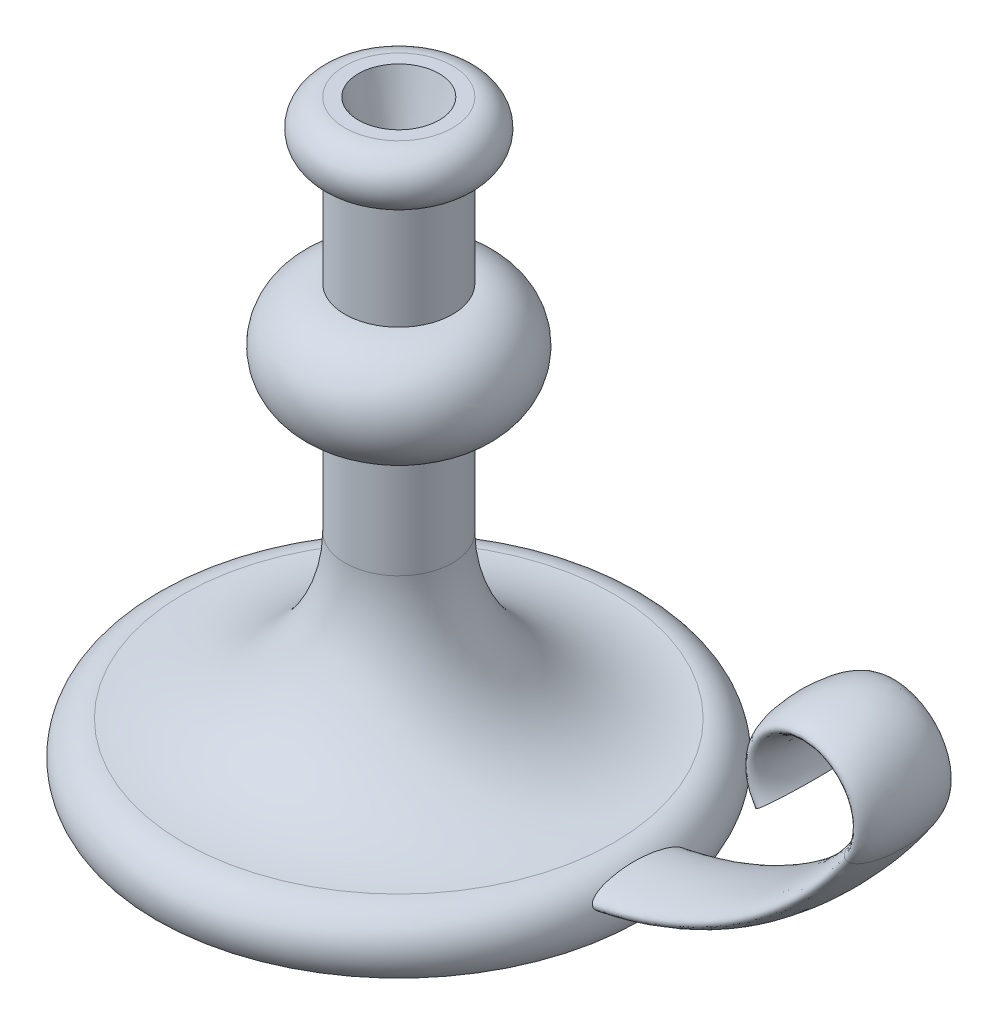
from build123d import *

# Parameters (mm, degrees)
SKETCH3_RX         = 17.5
SKETCH3_RY         = 5
SKETCH4_R          = 15
CUT_EXTRUDE1_DEPTH = 25
CUT_EXTRUDE1_DRAFT = -15


with BuildPart() as part:
    # Sketch1 → Revolve1 (revolve)
    with BuildSketch(Plane.XY, mode=Mode.PRIVATE) as revolve1_sk:
        with BuildLine():
            Line((0, 0), (0, -220))
            Line((0, -220), (90, -220))
            ThreePointArc((90, -220), (91.180339887, -206.909830056), (80, -200))
            ThreePointArc((80, -200), (37.573593129, -182.426406871), (20, -140))
            Line((20, -140), (20, -100))
            ThreePointArc((20, -100), (40, -80), (20, -60))
            Line((20, -60), (20, -20))
            ThreePointArc((20, -20), (30, -10), (20, 0))
            Line((20, 0), (0, 0))
        make_face()
    revolve(revolve1_sk.sketch.rotate(Axis((0, 0, 0), (0, -1, 0)), 90), axis=Axis((0, 0, 0), (0, -1, 0)))

    # Sweep1: sweep along a path in Sketch2
    with BuildLine(Plane.XY) as sweep1_path:
        Line((0, -210), (60, -210))
        ThreePointArc((60, -210), (129.821200219, -192.759180474), (183.592070943, -145))
        ThreePointArc((183.592070943, -145), (167.113128151, -113.666666667), (150.634185358, -145))
    # Sketch3 → Sweep1 (sweep)
    with BuildSketch(Plane(origin=(0, 0, 0), x_dir=(0, 0, -1), z_dir=(1, 0, 0))):
        with Locations(Location((0, -210), (0, 0, -180))):
            Ellipse(SKETCH3_RX, SKETCH3_RY)
    sweep(path=sweep1_path.line)


with BuildPart() as cut_extrude1_tool:
    # Sketch4 → Cut-Extrude1 (with draft: the straight prism first)
    with BuildSketch(Plane(origin=(0, 0, 0), x_dir=(1, 0, 0), z_dir=(0, 1, 0))):
        Circle(SKETCH4_R)
    extrude(amount=-CUT_EXTRUDE1_DEPTH)
    # Cut-Extrude1: the draft: its side faces are tilted about the plane it starts from
    cut_extrude1_sides = [cut_extrude1_tool.faces().sort_by_distance(p)[0] for p in [
        (-15, -12.5, 0),
    ]]
    draft(cut_extrude1_sides, Plane(origin=(0, 0, 0), x_dir=(1, 0, 0), z_dir=(0, 1, 0)), CUT_EXTRUDE1_DRAFT)


with BuildPart() as part_1:
    add(part.part)

    # Cut-Extrude1: cut by cut_extrude1_tool
    add(cut_extrude1_tool.part, mode=Mode.SUBTRACT)


solid = part_1.part
